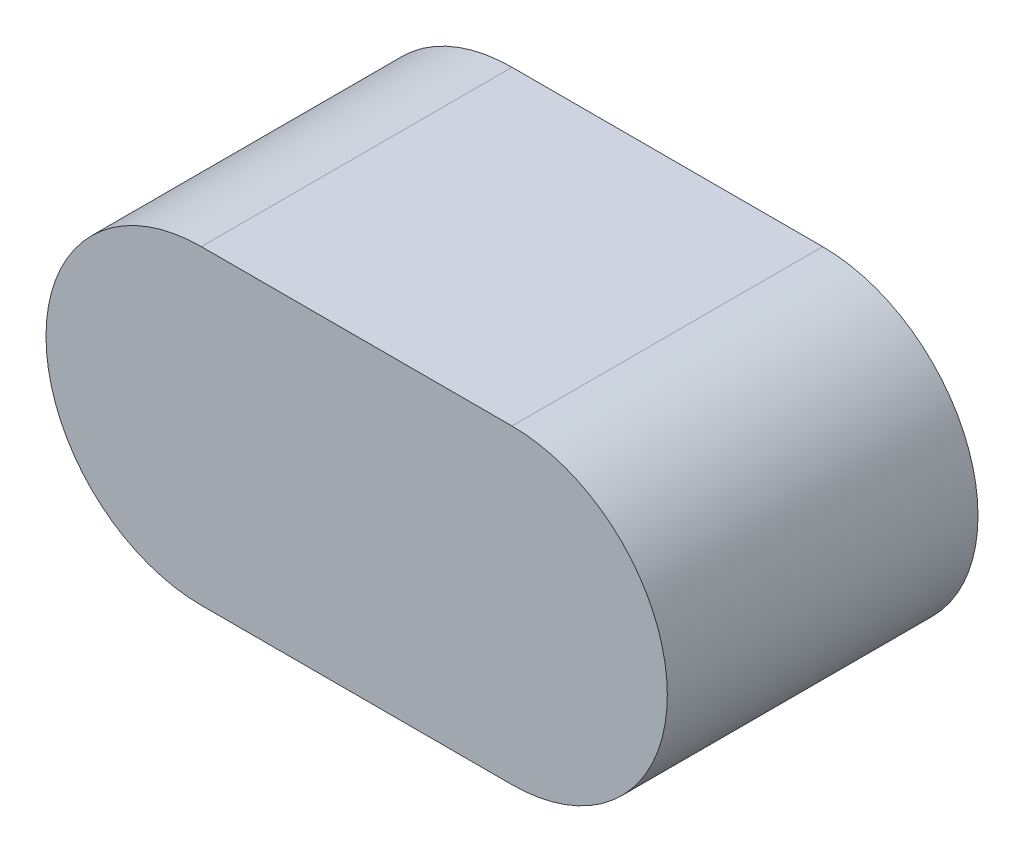
from build123d import *

# Parameters (mm, degrees)
EXTRUDE_1_DEPTH = 3


with BuildPart() as part:
    # 草图1 → 凸台-拉伸1 (new body)
    with BuildSketch(Plane.XY):
        with BuildLine():
            Line((-4.142857143, 3.69047619), (-1.142857143, 3.69047619))
            ThreePointArc((-1.142857143, 3.69047619), (0.357142857, 2.19047619), (-1.142857143, 0.69047619))
            Line((-1.142857143, 0.69047619), (-4.142857143, 0.69047619))
            ThreePointArc((-4.142857143, 0.69047619), (-5.642857143, 2.19047619), (-4.142857143, 3.69047619))
        make_face()
    extrude(amount=EXTRUDE_1_DEPTH)


solid = part.part
